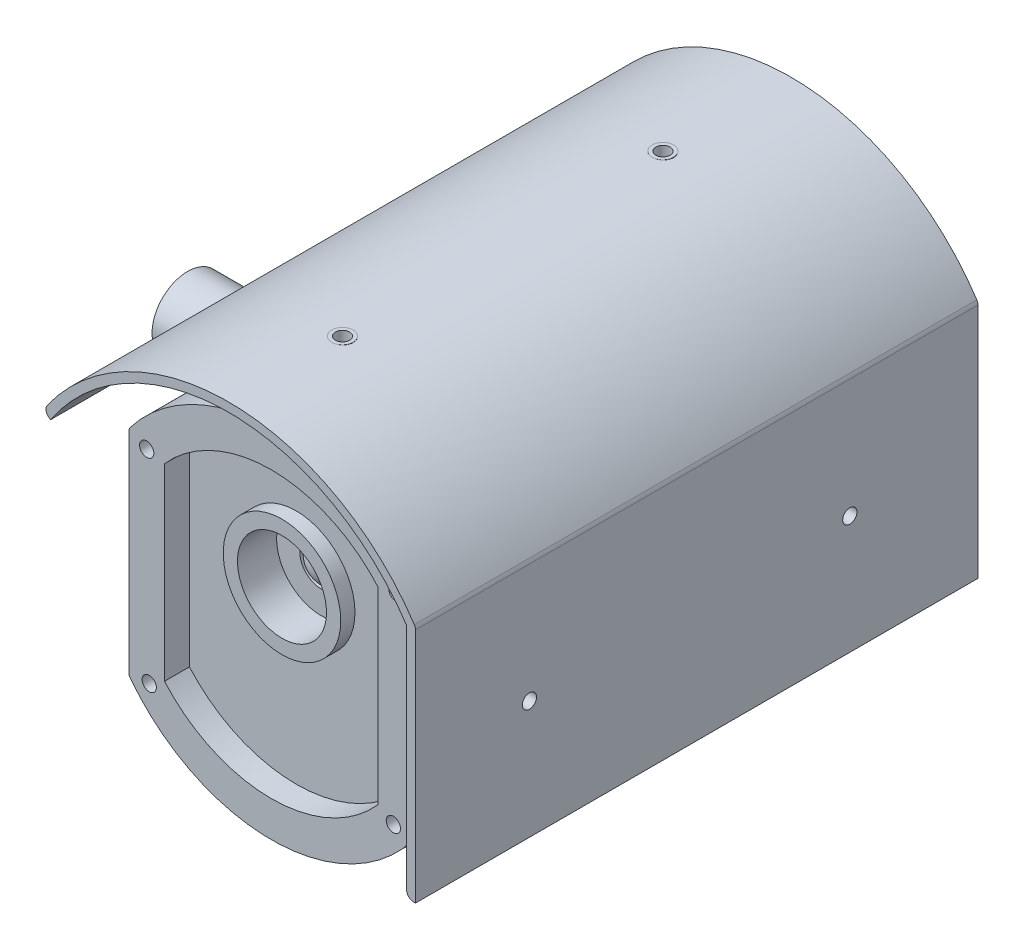
from build123d import *

# Parameters (mm, degrees)
BOSS_EXTRUDE1_DEPTH      = 140
CUT_EXTRUDE1_DEPTH       = 7
BOSS_EXTRUDE2_DEPTH      = 12
BOSS_EXTRUDE2_DEPTH_BACK = 146
SKETCH4_R                = 16.5
SKETCH4_R_2              = 12.5
BOSS_EXTRUDE3_DEPTH      = 4
CUT_EXTRUDE2_START       = -7
SKETCH5_R                = 12.5
CUT_EXTRUDE2_DEPTH       = 7
SKETCH6_R                = 6
CUT_EXTRUDE3_DEPTH       = 1
DOME1_FACE_RADIUS        = 6
DOME1_HEIGHT             = 3
SKETCH7_R                = 3
BOSS_EXTRUDE4_DEPTH      = 12.5
SKETCH8_R                = 2
CUT_EXTRUDE4_DEPTH       = 17
BOSS_EXTRUDE5_REACH      = 198.256
BOSS_EXTRUDE5_END_RADIUS = 50
SKETCH9_R                = 3
SKETCH10_R               = 2
CUT_EXTRUDE5_DEPTH       = 17
BOSS_EXTRUDE6_DEPTH      = 7
SKETCH12_W               = 70
SKETCH12_H               = 3.5
CUT_EXTRUDE6_DEPTH       = 5
SKETCH13_R               = 10
BOSS_EXTRUDE7_DEPTH      = 50
SKETCH14_R               = 15
SKETCH14_R_2             = 10
BOSS_EXTRUDE8_DEPTH      = 20
FILLET1_R                = 2
SKETCH15_R               = 2
CUT_EXTRUDE7_DEPTH       = 5


with BuildPart() as part:
    # Sketch1 → Boss-Extrude1 (new body)
    with BuildSketch(Plane.XY):
        with BuildLine():
            Line((-40, -30), (-40, 30))
            ThreePointArc((-40, 30), (0, 50), (40, 30))
            Line((40, 30), (40, -30))
            ThreePointArc((40, -30), (0, -50), (-40, -30))
        make_face()
    extrude(amount=BOSS_EXTRUDE1_DEPTH)

    # Sketch2 → Cut-Extrude1 (cut)
    with BuildSketch(Plane.XY.offset(140)):
        with BuildLine():
            Line((-30, 26.457513111), (-30, -26.457513111))
            ThreePointArc((-30, -26.457513111), (0, -40), (30, -26.457513111))
            Line((30, -26.457513111), (30, 26.457513111))
            ThreePointArc((30, 26.457513111), (0, 40), (-30, 26.457513111))
        make_face()
    extrude(amount=-CUT_EXTRUDE1_DEPTH, mode=Mode.SUBTRACT)

    # Sketch4 → Boss-Extrude3 (add)
    with BuildSketch(Plane.XY.offset(133)):
        with Locations((0, 10)):
            Circle(SKETCH4_R)
        with Locations((0, 10)):
            Circle(SKETCH4_R_2, mode=Mode.SUBTRACT)
    extrude(amount=BOSS_EXTRUDE3_DEPTH)

    # Sketch5 → Cut-Extrude2 (cut)
    with BuildSketch(Plane.XY.offset(133).offset(CUT_EXTRUDE2_START)):
        with Locations((0, 10)):
            Circle(SKETCH5_R)
    extrude(amount=CUT_EXTRUDE2_DEPTH, mode=Mode.SUBTRACT)

    # Sketch6 → Cut-Extrude3 (cut)
    with BuildSketch(Plane.XY.offset(126)):
        with Locations((0, 10)):
            Circle(SKETCH6_R)
    extrude(amount=-CUT_EXTRUDE3_DEPTH, mode=Mode.SUBTRACT)

    # Dome1: a dome of height H over a round flat face of radius A is a cap of a sphere of radius (A * A + H * H) / (2 * H)
    dome1_r = (DOME1_FACE_RADIUS * DOME1_FACE_RADIUS + DOME1_HEIGHT * DOME1_HEIGHT) / (2 * DOME1_HEIGHT)
    dome1_base = Plane((0, 10, 125), z_dir=(0, 0, 1))
    with Locations(dome1_base.offset(DOME1_HEIGHT - dome1_r)):
        dome1_ball = Sphere(dome1_r, mode=Mode.PRIVATE)
    add(split(dome1_ball, bisect_by=dome1_base, keep=Keep.TOP, mode=Mode.PRIVATE))



with BuildPart() as body_2:
    # Sketch3 → Boss-Extrude2 (new, two sides: drawn at the far end of the back side and taken through both)
    with BuildSketch(Plane.XY.offset(140).offset(-BOSS_EXTRUDE2_DEPTH_BACK)):
        with BuildLine():
            Line((52.5, -33.166247904), (52.5, 33.911649916))
            ThreePointArc((52.5, 33.911649916), (0.380386371, 62.498842439), (-52.083333333, 34.5481749))
            Line((-52.083333333, 34.5481749), (-50, 33.166247904))
            ThreePointArc((-50, 33.166247904), (0, 60), (50, 33.166247904))
            Line((50, 33.166247904), (50, -33.166247904))
            Line((50, -33.166247904), (52.5, -33.166247904))
        make_face()
    extrude(amount=BOSS_EXTRUDE2_DEPTH + BOSS_EXTRUDE2_DEPTH_BACK)


with BuildPart() as part_1:
    add(part.part)

    add(body_2.part)  # Boss-Extrude4 merges body 2
    # Sketch7 → Boss-Extrude4 (add)
    with BuildSketch(Plane(origin=(52.5, 0, 0), x_dir=(0, 0, -1), z_dir=(1, 0, 0))):
        with Locations(Location((-120, 0, 0), (0, 0, 270))):
            Circle(SKETCH7_R)
        with Locations(Location((-30, 0, 0), (0, 0, 270))):
            Circle(SKETCH7_R)
    extrude(amount=-BOSS_EXTRUDE4_DEPTH)

    # Sketch8 → Cut-Extrude4 (cut)
    with BuildSketch(Plane(origin=(52.5, 0, 0), x_dir=(0, 0, -1), z_dir=(1, 0, 0))):
        with Locations((-120, 0)):
            Circle(SKETCH8_R)
        with Locations((-30, 0)):
            Circle(SKETCH8_R)
    extrude(amount=-CUT_EXTRUDE4_DEPTH, mode=Mode.SUBTRACT)

    # Boss-Extrude5: up to this cylinder (the profile starts outside it)
    boss_extrude5_end = Plane(origin=(0, 0, 75), z_dir=(0, 0, -1)) * Cylinder(BOSS_EXTRUDE5_END_RADIUS, 587.512, mode=Mode.PRIVATE)
    # Sketch9 → Boss-Extrude5 (add, up to the surface)
    with BuildSketch(Plane(origin=(0, 62.5, 0), x_dir=(-1, 0, 0), z_dir=(0, 1, 0)), mode=Mode.PRIVATE) as boss_extrude5_sk1:
        with Locations(Location((0, 120, 0), (0, 0, 90))):
            Circle(SKETCH9_R)
    boss_extrude5_tool1 = extrude(boss_extrude5_sk1.sketch, amount=-BOSS_EXTRUDE5_REACH, mode=Mode.PRIVATE) - boss_extrude5_end
    add(boss_extrude5_tool1.solids().sort_by_distance((0, 62.5, 120))[0])
    # Sketch9 → Boss-Extrude5 (add, up to the surface)
    with BuildSketch(Plane(origin=(0, 62.5, 0), x_dir=(-1, 0, 0), z_dir=(0, 1, 0)), mode=Mode.PRIVATE) as boss_extrude5_sk2:
        with Locations(Location((0, 30, 0), (0, 0, 90))):
            Circle(SKETCH9_R)
    boss_extrude5_tool2 = extrude(boss_extrude5_sk2.sketch, amount=-BOSS_EXTRUDE5_REACH, mode=Mode.PRIVATE) - boss_extrude5_end
    add(boss_extrude5_tool2.solids().sort_by_distance((0, 62.5, 30))[0])

    # Sketch10 → Cut-Extrude5 (cut)
    with BuildSketch(Plane(origin=(0, 62.5, 0), x_dir=(1, 0, 0), z_dir=(0, 1, 0))):
        with Locations(Location((0, -30, 0), (0, 0, 270))):
            Circle(SKETCH10_R)
        with Locations(Location((0, -120, 0), (0, 0, 270))):
            Circle(SKETCH10_R)
    extrude(amount=-CUT_EXTRUDE5_DEPTH, mode=Mode.SUBTRACT)

    # Sketch11 → Boss-Extrude6 (add)
    with BuildSketch(Plane(origin=(0, 0, 0), x_dir=(-1, 0, 0), z_dir=(0, 0, -1))):
        with BuildLine():
            Line((-42, 30.659419434), (-42, -30.659419434))
            ThreePointArc((-42, -30.659419434), (0, -52), (42, -30.659419434))
            Line((42, -30.659419434), (42, 30.659419434))
            ThreePointArc((42, 30.659419434), (0, 52), (-42, 30.659419434))
        make_face()
        with BuildLine():
            Line((-40, 30), (-40, -30))
            ThreePointArc((-40, -30), (0, -50), (40, -30))
            Line((40, -30), (40, 30))
            ThreePointArc((40, 30), (0, 50), (-40, 30))
        make_face(mode=Mode.SUBTRACT)
    extrude(amount=-BOSS_EXTRUDE6_DEPTH)

    # Sketch12 → Cut-Extrude6 (cut)
    with BuildSketch(Plane(origin=(0, 0, 0), x_dir=(-1, 0, 0), z_dir=(0, 0, -1))):
        with BuildLine():
            ThreePointArc((16.155494421, 42), (0, 45), (-16.155494421, 42))
            Line((-16.155494421, 42), (16.155494421, 42))
        make_face()
        with BuildLine():
            ThreePointArc((-21.558061137, 39.5), (-24.342017693, 37.84793488), (-27, 36))
            Line((-27, 36), (27, 36))
            ThreePointArc((27, 36), (24.342017693, 37.84793488), (21.558061137, 39.5))
            Line((21.558061137, 39.5), (-21.558061137, 39.5))
        make_face()
        with BuildLine():
            ThreePointArc((-30.045798375, 33.5), (-31.841535092, 31.798060365), (-33.541019662, 30))
            Line((-33.541019662, 30), (33.541019662, 30))
            ThreePointArc((33.541019662, 30), (31.841535092, 31.798060365), (30.045798375, 33.5))
            Line((30.045798375, 33.5), (-30.045798375, 33.5))
        make_face()
        with Locations((0, 25.75)):
            Rectangle(SKETCH12_W, SKETCH12_H)
        with Locations((0, 19.75)):
            Rectangle(SKETCH12_W, SKETCH12_H)
        with Locations((0, 13.75)):
            Rectangle(SKETCH12_W, SKETCH12_H)
        with Locations((0, 7.75)):
            Rectangle(SKETCH12_W, SKETCH12_H)
        with Locations((0, 1.75)):
            Rectangle(SKETCH12_W, SKETCH12_H)
        with Locations((0, -4.25)):
            Rectangle(SKETCH12_W, SKETCH12_H)
        with Locations((0, -10.25)):
            Rectangle(SKETCH12_W, SKETCH12_H)
        with Locations((0, -16.25)):
            Rectangle(SKETCH12_W, SKETCH12_H)
        with Locations((0, -22.25)):
            Rectangle(SKETCH12_W, SKETCH12_H)
        with BuildLine():
            Line((35, -26.5), (-35, -26.5))
            Line((-35, -26.5), (-35, -28.284271247))
            ThreePointArc((-35, -28.284271247), (-34.281245243, -29.151264546), (-33.541019662, -30))
            Line((-33.541019662, -30), (33.541019662, -30))
            ThreePointArc((33.541019662, -30), (34.281245243, -29.151264546), (35, -28.284271247))
            Line((35, -28.284271247), (35, -26.5))
        make_face()
        with BuildLine():
            Line((31.124748995, -32.5), (-31.124748995, -32.5))
            ThreePointArc((-31.124748995, -32.5), (-29.115015223, -34.31203708), (-27, -36))
            Line((-27, -36), (27, -36))
            ThreePointArc((27, -36), (29.115015223, -34.31203708), (31.124748995, -32.5))
        make_face()
        with BuildLine():
            Line((23.296995514, -38.5), (-23.296995514, -38.5))
            ThreePointArc((-23.296995514, -38.5), (-19.803717846, -40.408077899), (-16.155494421, -42))
            Line((-16.155494421, -42), (16.155494421, -42))
            ThreePointArc((16.155494421, -42), (19.803717846, -40.408077899), (23.296995514, -38.5))
        make_face()
    extrude(amount=-CUT_EXTRUDE6_DEPTH, mode=Mode.SUBTRACT)

    # Sketch13 → Boss-Extrude7 (add)
    with BuildSketch(Plane.ZY.offset(40)):
        with Locations(Location((73.5, 0, 0), (0, 0, 90))):
            Circle(SKETCH13_R)
    extrude(amount=BOSS_EXTRUDE7_DEPTH)

    # Sketch14 → Boss-Extrude8 (add)
    with BuildSketch(Plane.ZY.offset(40)):
        with Locations(Location((73.5, 0, 0), (0, 0, 90))):
            Circle(SKETCH14_R)
        with Locations(Location((73.5, 0, 0), (0, 0, 270))):
            Circle(SKETCH14_R_2, mode=Mode.SUBTRACT)
    extrude(amount=BOSS_EXTRUDE8_DEPTH)

    # Fillet1
    fillet1_edges = [part_1.edges().sort_by_distance(p)[0] for p in [
        (50, -33.166247904, 73),
        (-52.083333333, 34.5481749, 73),
        (52.5, 33.911649916, 73),
        (42, 30.659419434, 3.5),
        (-42, 30.659419434, 3.5),
        (-42, -30.659419434, 3.5),
        (42, -30.659419434, 3.5),
        (0, 52, 0),
        (42, 0, 0),
        (0, -52, 0),
        (-42, 0, 0),
        (-40, -15, 73.5),
        (50, 3, 120),
        (40, 3, 120),
        (40, 30, 73.5),
        (-40, 30, 73.5),
        (-40, -30, 73.5),
        (40, -30, 73.5),
        (50, 3, 30),
        (40, 3, 30),
        (-2e-09, 60.000000006, 117.000000018),
        (-2e-09, 50.000000007, 117.000000018),
        (0, 59.999999997, 26.999999988),
        (0, 49.999999997, 26.999999988),
    ]]
    fillet(fillet1_edges, radius=FILLET1_R)

    # Sketch15 → Cut-Extrude7 (cut)
    with BuildSketch(Plane.XY.offset(140)):
        with Locations((35, 27.5)):
            Circle(SKETCH15_R)
        with Locations((-35, 27.5)):
            Circle(SKETCH15_R)
        with Locations((34.281245243, -29.151264546)):
            Circle(SKETCH15_R)
        with Locations((-34.281245243, -29.151264546)):
            Circle(SKETCH15_R)
    extrude(amount=-CUT_EXTRUDE7_DEPTH, mode=Mode.SUBTRACT)


solid = part_1.part
